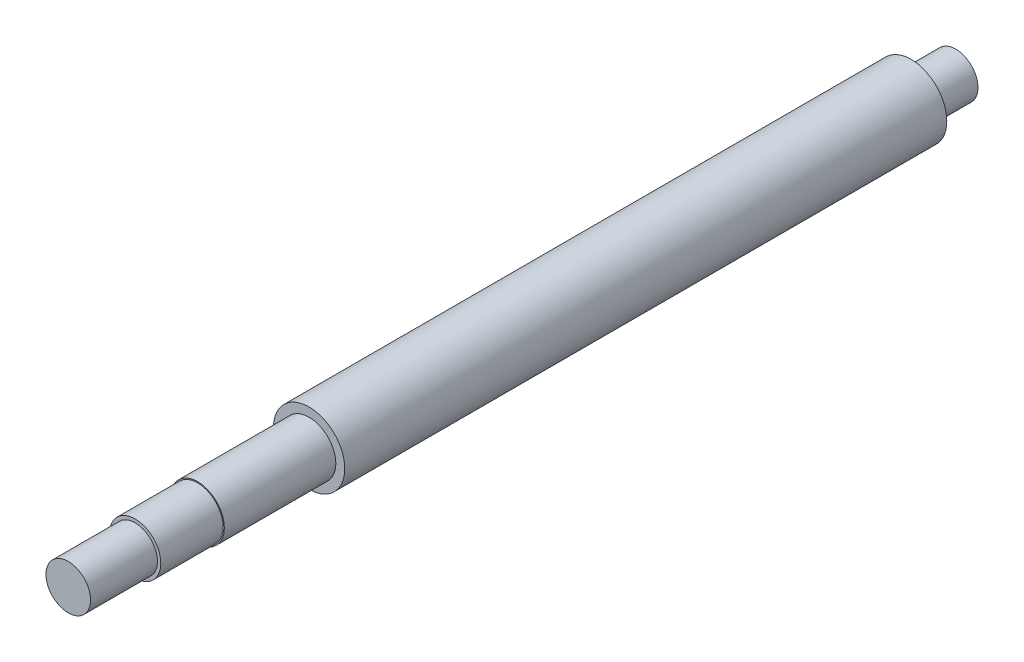
from build123d import *

# Parameters (mm, degrees)
SKETCH_1_R      = 5
EXTRUDE_1_DEPTH = 10
SKETCH_2_R      = 8
EXTRUDE_2_DEPTH = 135
SKETCH_3_R      = 6
EXTRUDE_3_DEPTH = 25
SKETCH_4_R      = 5.75
EXTRUDE_4_DEPTH = 14
SKETCH_5_R      = 5
EXTRUDE_5_DEPTH = 15


with BuildPart() as part:
    # 스케치1 → 보스-돌출1 (new body)
    with BuildSketch(Plane.XY):
        Circle(SKETCH_1_R)
    extrude(amount=EXTRUDE_1_DEPTH)

    # 스케치2 → 보스-돌출2 (add)
    with BuildSketch(Plane.XY.offset(10)):
        Circle(SKETCH_2_R)
    extrude(amount=EXTRUDE_2_DEPTH)

    # 스케치3 → 보스-돌출3 (add)
    with BuildSketch(Plane.XY.offset(145)):
        Circle(SKETCH_3_R)
    extrude(amount=EXTRUDE_3_DEPTH)

    # 스케치4 → 보스-돌출4 (add)
    with BuildSketch(Plane.XY.offset(170)):
        Circle(SKETCH_4_R)
    extrude(amount=EXTRUDE_4_DEPTH)

    # 스케치5 → 보스-돌출5 (add)
    with BuildSketch(Plane.XY.offset(184)):
        Circle(SKETCH_5_R)
    extrude(amount=EXTRUDE_5_DEPTH)


solid = part.part
